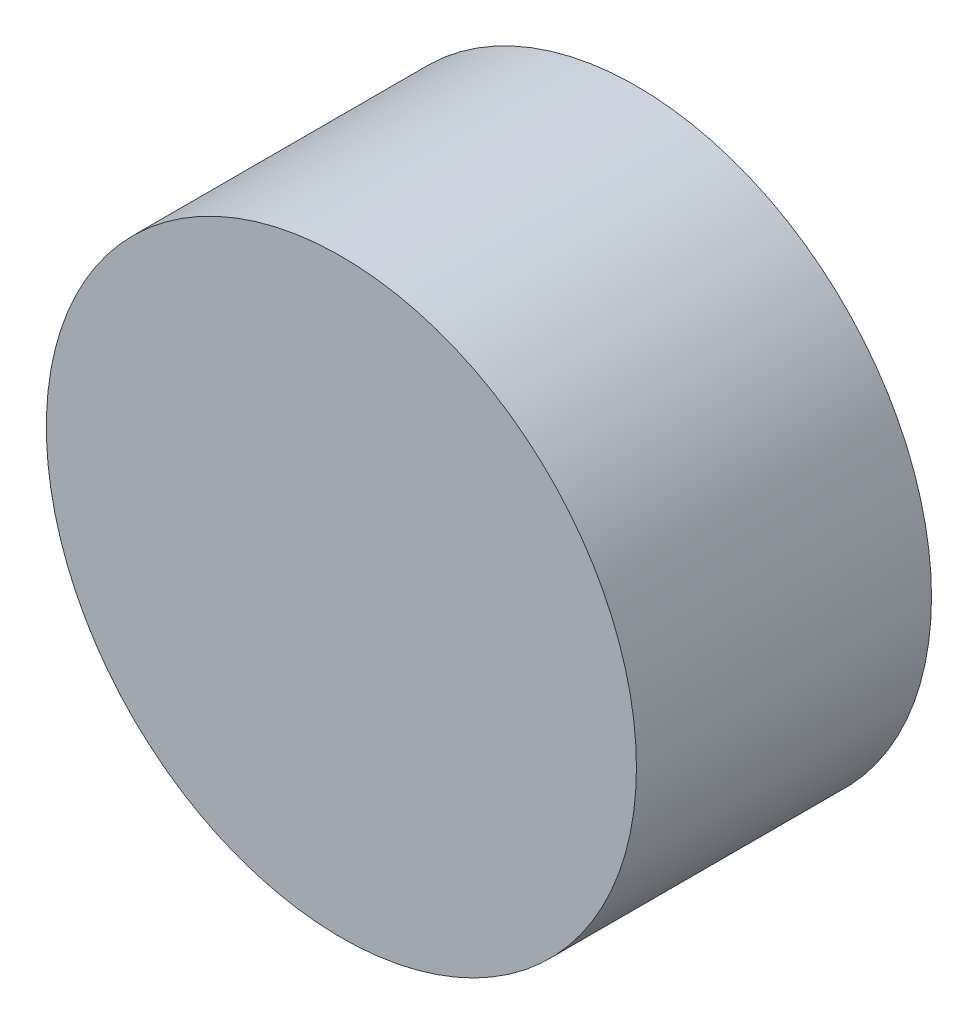
from build123d import *

# Parameters (mm, degrees)
SKETCH1_R           = 1
BOSS_EXTRUDE1_DEPTH = 0.5


with BuildPart() as part:
    # Sketch1 → Boss-Extrude1 (new, symmetric)
    with BuildSketch(Plane.XY):
        Circle(SKETCH1_R)
    extrude(amount=BOSS_EXTRUDE1_DEPTH, both=True)


solid = part.part
